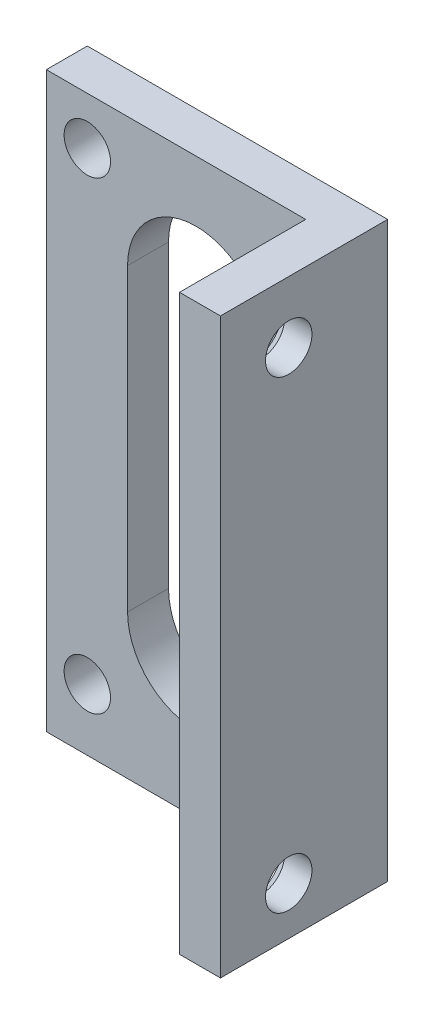
from build123d import *

# Parameters (mm, degrees)
SKETCH_1_R          = 1.7
EXTRUDE_2_DEPTH     = 3
SKETCH_2_W          = 3
SKETCH_2_H          = 42
EXTRUDE_3_DEPTH     = 19
SKETCH_3_R          = 1.7
CUT_EXTRUDE_1_DEPTH = 5
CUT_EXTRUDE_2_DEPTH = 5
CHAMFER_1_SIZE      = 1


with BuildPart() as part:
    # Эскиз1 → Бобышка-Вытянуть2 (new body)
    with BuildSketch(Plane(origin=(0, 0, 0), x_dir=(0, 0, -1), z_dir=(1, 0, 0))):
        Polygon((0, 38.5), (-5, 38.5), (-5, -3.5), (7.246656809, -3.5), (7.246656809, 38.5), align=None)
        Circle(SKETCH_1_R, mode=Mode.SUBTRACT)
        with BuildLine():
            ThreePointArc((0, 32.3), (-1.7, 34), (0, 35.7))
            ThreePointArc((0, 35.7), (1.7, 34), (0, 32.3))
        make_face(mode=Mode.SUBTRACT)
    extrude(amount=EXTRUDE_2_DEPTH)

    # Эскиз2 → Бобышка-Вытянуть3 (add)
    with BuildSketch(Plane.ZY):
        with Locations((-5.746656809, 17.5)):
            Rectangle(SKETCH_2_W, SKETCH_2_H)
    extrude(amount=EXTRUDE_3_DEPTH)

    # Эскиз3 → Вырез-Вытянуть1 (cut)
    with BuildSketch(Plane.XY.offset(-4.246656809)):
        with Locations((-16, 35.010378706)):
            Circle(SKETCH_3_R)
        with Locations((-16, 1.010378706)):
            Circle(SKETCH_3_R)
    extrude(amount=-CUT_EXTRUDE_1_DEPTH, mode=Mode.SUBTRACT)

    # Эскиз4 → Вырез-Вытянуть2 (cut)
    with BuildSketch(Plane.XY.offset(-4.246656809)):
        with BuildLine():
            Line((-3.030961954, 29.041213722), (-3.030961954, 7.066639766))
            ThreePointArc((-3.030961954, 7.066639766), (-8.041074018, 2.056527703), (-13.051186081, 7.066639766))
            Line((-13.051186081, 7.066639766), (-13.051186081, 29.041213722))
            ThreePointArc((-13.051186081, 29.041213722), (-8.041074018, 34.051325785), (-3.030961954, 29.041213722))
        make_face()
    extrude(amount=-CUT_EXTRUDE_2_DEPTH, mode=Mode.SUBTRACT)

    # Фаска1
    chamfer_1_edges = [part.edges().sort_by_distance(p)[0] for p in [
        (0, 35.7, 0),
        (0, 0, 1.7),
    ]]
    chamfer(chamfer_1_edges, length=CHAMFER_1_SIZE)


solid = part.part
